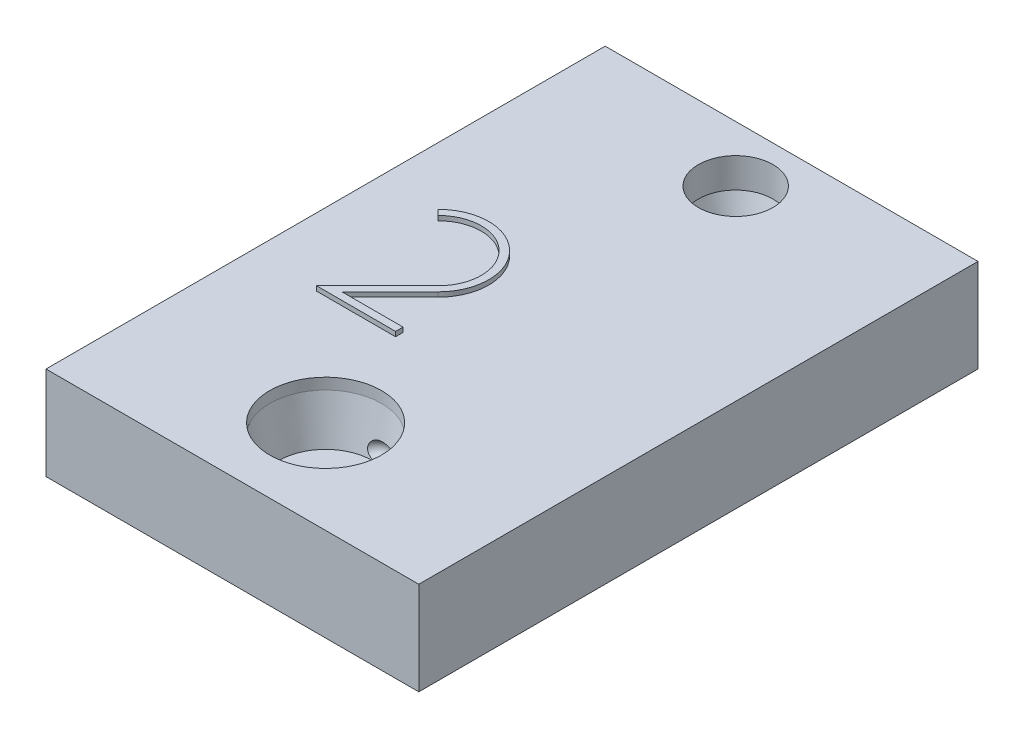
from build123d import *
from build123d.topology import SkipClean

# Parameters (mm, degrees)
SKETCH1_W           = 40
SKETCH1_H           = 10
BOSS_EXTRUDE1_DEPTH = 60
SKETCH10_R          = 1
BOSS_EXTRUDE2_DEPTH = 0.5


with BuildPart() as part:
    # Sketch1 → Boss-Extrude1 (new body)
    with BuildSketch(Plane.XY):
        Rectangle(SKETCH1_W, SKETCH1_H)
    extrude(amount=BOSS_EXTRUDE1_DEPTH)

    # Cut-Sweep1: sweep along a path in Sketch2
    with BuildLine(Plane(origin=(0, 0, 0), x_dir=(1, 0, 0), z_dir=(0, 1, 0))) as cut_sweep1_path:
        Line((0, -50), (0, -46))
        ThreePointArc((0, -46), (0.292893219, -45.292893219), (1, -45))
        Line((1, -45), (15, -45))
        ThreePointArc((15, -45), (16.5, -43.5), (15, -42))
        Line((15, -42), (0, -42))
        Line((0, -42), (-15, -42))
        ThreePointArc((-15, -42), (-16.5, -40.5), (-15, -39))
        Line((-15, -39), (15, -39))
        ThreePointArc((15, -39), (16.5, -37.5), (15, -36))
        Line((15, -36), (-15, -36))
        ThreePointArc((-15, -36), (-16.5, -34.5), (-15, -33))
        Line((-15, -33), (15.355579664, -33))
        ThreePointArc((15.355579664, -33), (16.855579664, -31.5), (15.355579664, -30))
        Line((15.355579664, -30), (-15, -30))
        ThreePointArc((-15, -30), (-16.5, -28.5), (-15, -27))
        Line((-15, -27), (15, -27))
        ThreePointArc((15, -27), (16.5, -25.5), (15, -24))
        Line((15, -24), (-15, -24))
        ThreePointArc((-15, -24), (-16.5, -22.5), (-15, -21))
        Line((-15, -21), (15, -21))
        ThreePointArc((15, -21), (16.5, -19.5), (15, -18))
        Line((15, -18), (-15, -18))
        ThreePointArc((-15, -18), (-16.5, -16.5), (-15, -15))
        Line((-15, -15), (15, -15))
        ThreePointArc((15, -15), (16.5, -13.5), (15, -12))
        Line((15, -12), (1, -12))
        ThreePointArc((1, -12), (0.292893219, -11.707106781), (0, -11))
        Line((0, -11), (0, -6))
    # Sketch10 → Cut-Sweep1 (sweep, cut)
    with BuildSketch(Plane(origin=(0, 0, 6), x_dir=(-1, 0, 0), z_dir=(0, 0, -1))):
        Circle(SKETCH10_R)
    sweep(path=cut_sweep1_path.line, mode=Mode.SUBTRACT)

    # Sketch13 → Cut-Revolve1 (revolve, cut)
    with SkipClean():  # the faces are left unmerged after this step: merging them gives an invalid solid
        with BuildSketch(Plane(origin=(0, 0, 0), x_dir=(0, 0, -1), z_dir=(1, 0, 0)), mode=Mode.PRIVATE) as cut_revolve1_sk:
            Polygon((-50, -1), (-55, -1), (-56, 3.8), (-56, 29), (-50, 29), align=None)
        revolve(cut_revolve1_sk.sketch.rotate(Axis((0, -1, 50), (0, 1, 0)), 168.465480965), axis=Axis((0, -1, 50), (0, 1, 0)), mode=Mode.SUBTRACT)

    # Sketch14 → Cut-Revolve2 (revolve, cut)
    with SkipClean():  # the faces are left unmerged after this step: merging them gives an invalid solid
        with BuildSketch(Plane(origin=(0, 0, 0), x_dir=(0, 0, -1), z_dir=(1, 0, 0)), mode=Mode.PRIVATE) as cut_revolve2_sk:
            Polygon((-6, -1), (-3, -1), (-2, 1.8), (-2, 29), (-6, 29), align=None)
        revolve(cut_revolve2_sk.sketch.rotate(Axis((0, -1, 6), (0, 1, 0)), 179.999999998), axis=Axis((0, -1, 6), (0, 1, 0)), mode=Mode.SUBTRACT)

    # Sketch15 → Boss-Extrude2 (add)
    with SkipClean():  # the faces are left unmerged after this step: merging them gives an invalid solid
        with BuildSketch(Plane(origin=(0, 5, 0), x_dir=(1, 0, 0), z_dir=(0, 1, 0))):
            with BuildLine():
                Line((-4.241700368, -38.250810998), (-12.725101104, -38.250810998))
                Line((-12.725101104, -38.250810998), (-6.194229109, -31.719939003))
                ThreePointArc((-6.194229109, -31.719939003), (-6.194229109, -25.189067007), (-12.725101104, -25.189067007))
                Line((-12.725101104, -25.189067007), (-13.290786529, -24.623381582))
                ThreePointArc((-13.290786529, -24.623381582), (-5.628543684, -24.623381582), (-5.628543684, -32.285624428))
                Line((-5.628543684, -32.285624428), (-10.793730254, -37.450810998))
                Line((-10.793730254, -37.450810998), (-4.241700368, -37.450810998))
                Line((-4.241700368, -37.450810998), (-4.241700368, -38.250810998))
            make_face()
        extrude(amount=BOSS_EXTRUDE2_DEPTH)


solid = part.part
